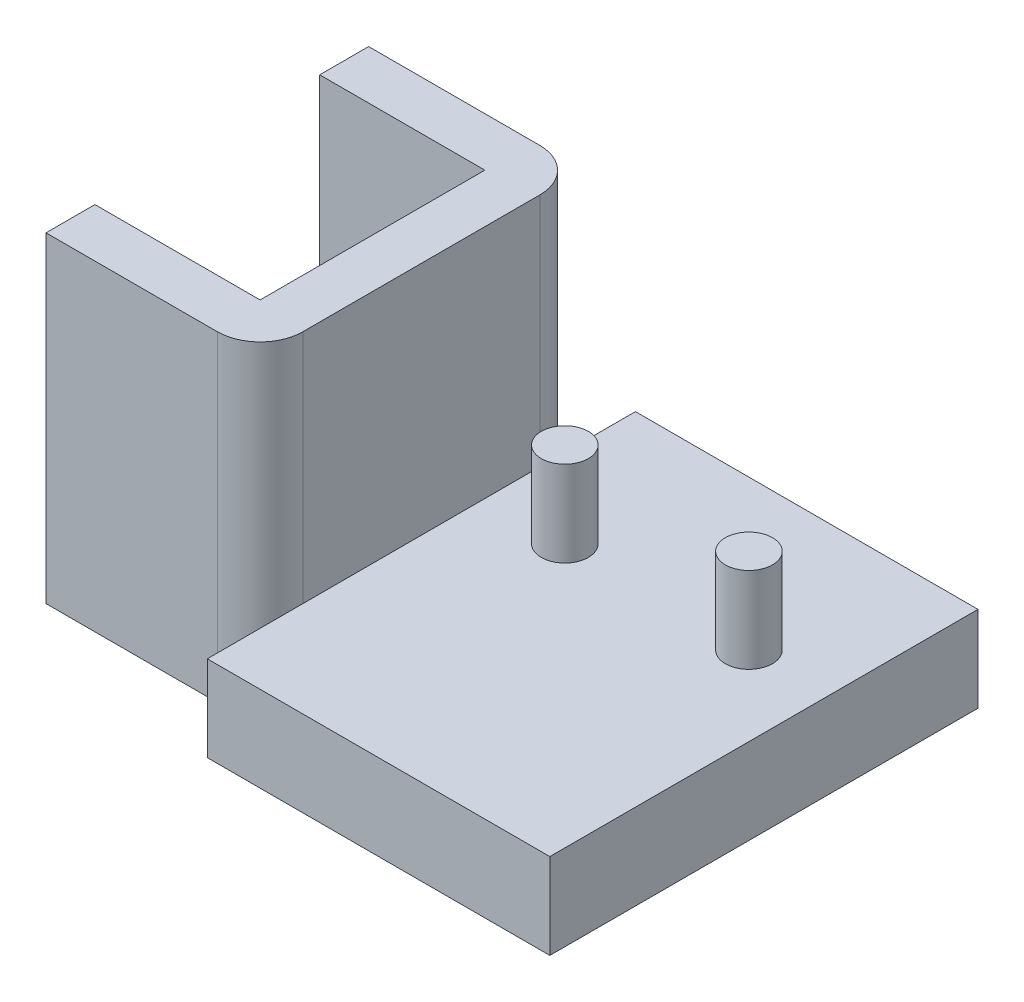
from build123d import *

# Parameters (mm, degrees)
EXTRUDE_3_DEPTH = 15
EXTRUDE_4_DEPTH = 4
SKETCH_8_R      = 1.1
EXTRUDE_5_DEPTH = 4


with BuildPart() as part:
    # 草图3 → 凸台-拉伸3 (new body)
    with BuildSketch(Plane(origin=(0, 0, 0), x_dir=(1, 0, 0), z_dir=(0, 1, 0))):
        with BuildLine():
            Line((1.616451797, 11.860683611), (-6.383548203, 11.860683611))
            Line((-6.383548203, 11.860683611), (-6.383548203, 9.575683611))
            Line((-6.383548203, 9.575683611), (1.331451797, 9.575683611))
            Line((1.331451797, 9.575683611), (1.331451797, -0.924316389))
            Line((1.331451797, -0.924316389), (-6.383548203, -0.924316389))
            Line((-6.383548203, -0.924316389), (-6.383548203, -3.209316389))
            Line((-6.383548203, -3.209316389), (1.616451797, -3.209316389))
            ThreePointArc((1.616451797, -3.209316389), (3.030665359, -2.623529952), (3.616451797, -1.209316389))
            Line((3.616451797, -1.209316389), (3.616451797, 9.860683611))
            ThreePointArc((3.616451797, 9.860683611), (3.030665359, 11.274897173), (1.616451797, 11.860683611))
        make_face()
    extrude(amount=EXTRUDE_3_DEPTH)

    # 草图3<4> → 凸台-拉伸4 (add)
    with BuildSketch(Plane(origin=(0, 0, 0), x_dir=(1, 0, 0), z_dir=(0, 1, 0))):
        Polygon((3.616451797, 14.325683611), (3.616451797, 9.860683611), (3.616451797, -1.209316389), (3.616451797, -5.674316389), (19.616451797, -5.674316389), (19.616451797, 14.325683611), align=None)
    extrude(amount=EXTRUDE_4_DEPTH)

    # 草图8 → 凸台-拉伸5 (add)
    with BuildSketch(Plane(origin=(0, 4, 0), x_dir=(1, 0, 0), z_dir=(0, 1, 0))):
        with Locations((7.316451797, 7.325683611)):
            Circle(SKETCH_8_R)
        with Locations((15.916451797, 7.325683611)):
            Circle(SKETCH_8_R)
    extrude(amount=EXTRUDE_5_DEPTH)


solid = part.part
